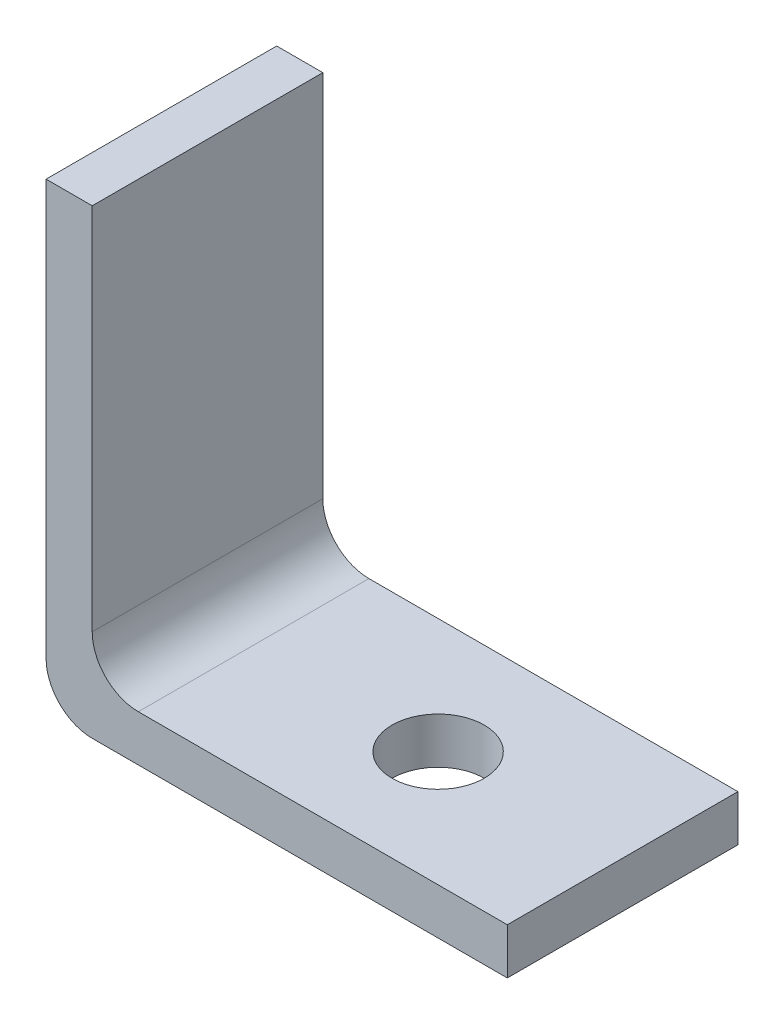
from build123d import *

# Parameters (mm, degrees)
BOSS_EXTRUDE1_DEPTH = 50
SKETCH2_R           = 10
CUT_EXTRUDE1_DEPTH  = 10


with BuildPart() as part:
    # Sketch1 → Boss-Extrude1 (new body)
    with BuildSketch(Plane.XY):
        with BuildLine():
            Line((10, 0), (100, 0))
            Line((100, 0), (100, 10))
            Line((100, 10), (20, 10))
            ThreePointArc((20, 10), (12.928932188, 12.928932188), (10, 20))
            Line((10, 20), (10, 100))
            Line((10, 100), (0, 100))
            Line((0, 100), (0, 10))
            ThreePointArc((0, 10), (2.928932188, 2.928932188), (10, 0))
        make_face()
    extrude(amount=BOSS_EXTRUDE1_DEPTH)

    # Sketch2 → Cut-Extrude1 (cut)
    with BuildSketch(Plane(origin=(0, 10, 0), x_dir=(1, 0, 0), z_dir=(0, 1, 0))):
        with Locations(Location((60, -25, 0), (0, 0, 180))):
            Circle(SKETCH2_R)
    extrude(amount=-CUT_EXTRUDE1_DEPTH, mode=Mode.SUBTRACT)


solid = part.part
